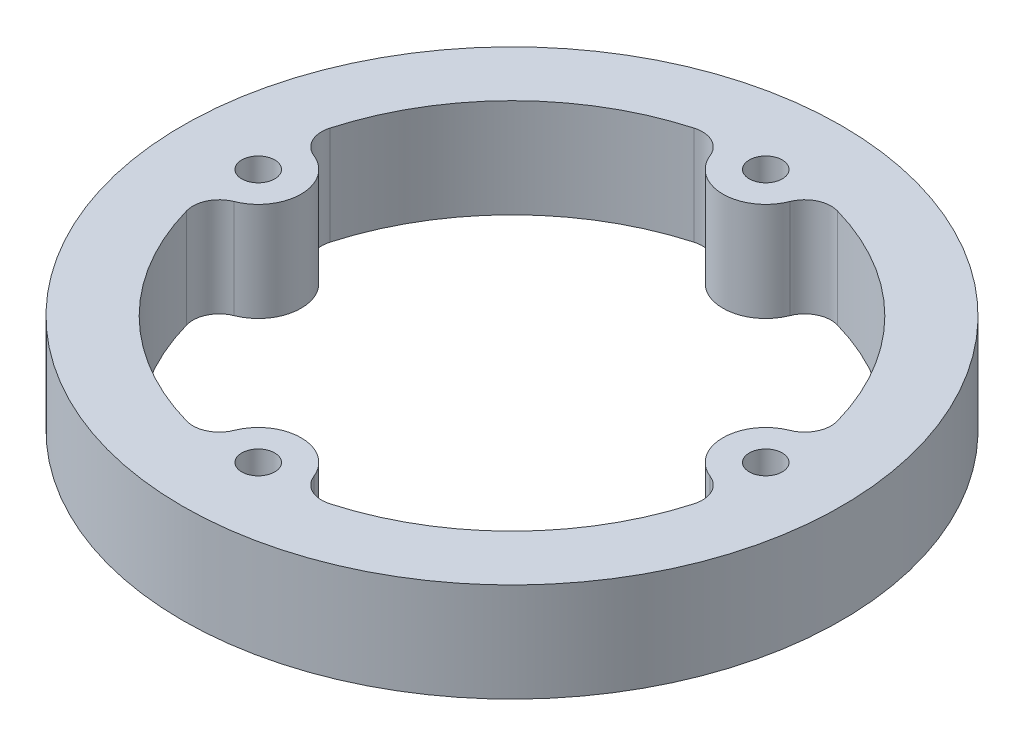
from build123d import *

# Parameters (mm, degrees)
SKETCH_1_R          = 50
SKETCH_1_R_2        = 32
EXTRUDE_1_DEPTH     = 15
SKETCH_2_R          = 2.5
CUT_EXTRUDE_1_DEPTH = 15
SKETCH_3_R          = 30
CUT_EXTRUDE_2_DEPTH = 15
FILLET_1_R          = 4


with BuildPart() as part:
    # 草图1 → 凸台-拉伸1 (new body)
    with BuildSketch(Plane(origin=(0, 0, 0), x_dir=(1, 0, 0), z_dir=(0, 1, 0))):
        with Locations(Location((0, 0, 0), (0, 0, 270))):
            Circle(SKETCH_1_R)
        with Locations(Location((0, 0, 0), (0, 0, 270))):
            Circle(SKETCH_1_R_2, mode=Mode.SUBTRACT)
    extrude(amount=EXTRUDE_1_DEPTH)

    # 草图2 → 切除-拉伸1 (cut)
    with BuildSketch(Plane(origin=(0, 15, 0), x_dir=(1, 0, 0), z_dir=(0, 1, 0))):
        with Locations(Location((38.5, 0, 0), (0, 0, 270))):
            Circle(SKETCH_2_R)
        with Locations(Location((-38.5, 0, 0), (0, 0, 90))):
            Circle(SKETCH_2_R)
        with Locations(Location((0, 38.5, 0), (0, 0, 270))):
            Circle(SKETCH_2_R)
        with Locations(Location((0, -38.5, 0), (0, 0, 90))):
            Circle(SKETCH_2_R)
    extrude(amount=-CUT_EXTRUDE_1_DEPTH, mode=Mode.SUBTRACT)

    # 草图3 → 切除-拉伸2 (cut)
    with BuildSketch(Plane(origin=(0, 15, 0), x_dir=(1, 0, 0), z_dir=(0, 1, 0))):
        with BuildLine():
            ThreePointArc((-39.480519481, -6.425619157), (-28.284271247, -28.284271247), (-6.425619157, -39.480519481))
            ThreePointArc((-6.425619157, -39.480519481), (0, -32), (6.425619157, -39.480519481))
            ThreePointArc((6.425619157, -39.480519481), (28.284271247, -28.284271247), (39.480519481, -6.425619157))
            ThreePointArc((39.480519481, -6.425619157), (32, 0), (39.480519481, 6.425619157))
            ThreePointArc((39.480519481, 6.425619157), (28.284271247, 28.284271247), (6.425619157, 39.480519481))
            ThreePointArc((6.425619157, 39.480519481), (0, 32), (-6.425619157, 39.480519481))
            ThreePointArc((-6.425619157, 39.480519481), (-28.284271247, 28.284271247), (-39.480519481, 6.425619157))
            ThreePointArc((-39.480519481, 6.425619157), (-32, 0), (-39.480519481, -6.425619157))
        make_face()
        Circle(SKETCH_3_R, mode=Mode.SUBTRACT)
    extrude(amount=-CUT_EXTRUDE_2_DEPTH, mode=Mode.SUBTRACT)

    # 圆角1
    fillet_1_edges = [part.edges().sort_by_distance(p)[0] for p in [
        (39.480519481, 7.5, 6.425619157),
        (6.425619157, 7.5, 39.480519481),
        (-6.425619157, 7.5, 39.480519481),
        (-39.480519481, 7.5, 6.425619157),
        (-39.480519481, 7.5, -6.425619157),
        (-6.425619157, 7.5, -39.480519481),
        (6.425619157, 7.5, -39.480519481),
        (39.480519481, 7.5, -6.425619157),
    ]]
    fillet(fillet_1_edges, radius=FILLET_1_R)


solid = part.part
